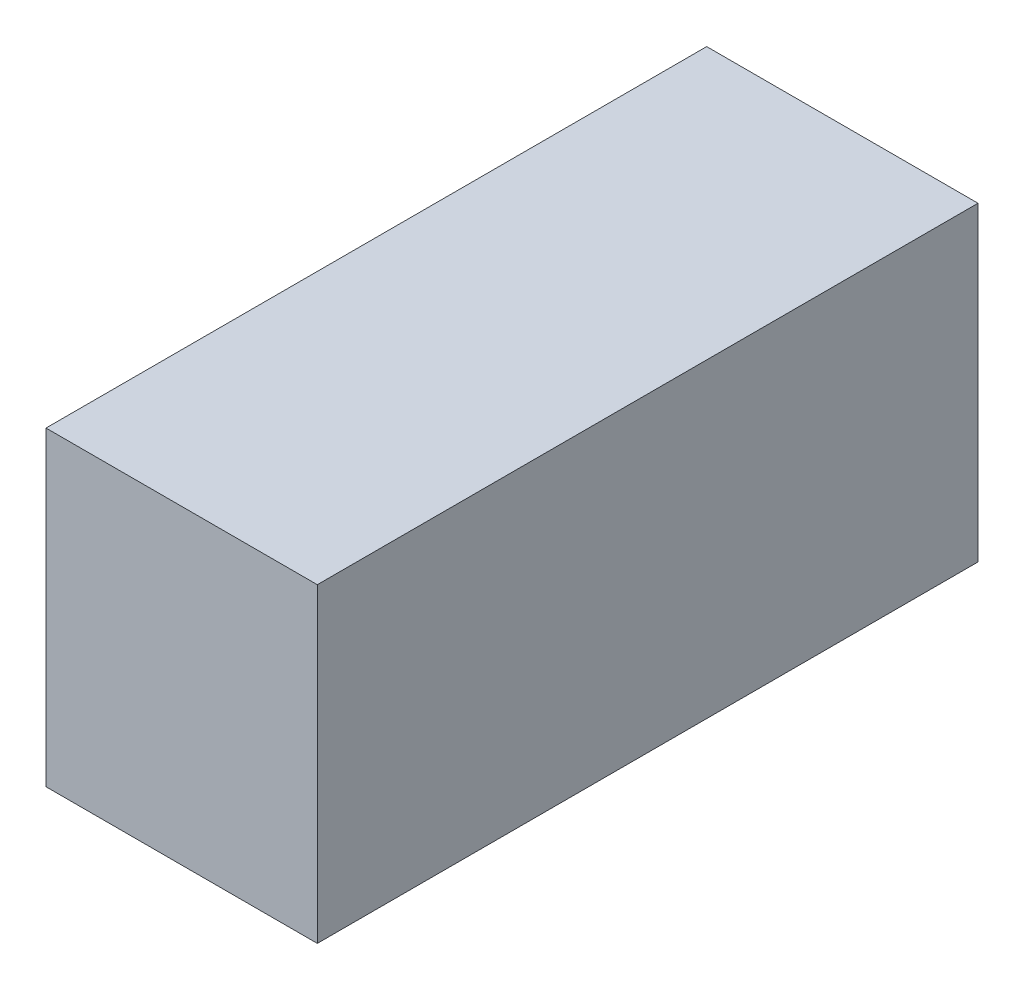
from build123d import *

# Parameters (mm, degrees)
SKETCH1_W           = 131
SKETCH1_H           = 150
BOSS_EXTRUDE1_DEPTH = 319


with BuildPart() as part:
    # Sketch1 → Boss-Extrude1 (new body)
    with BuildSketch(Plane.XY):
        with Locations((6.894736842, -41.388157895)):
            Rectangle(SKETCH1_W, SKETCH1_H)
    extrude(amount=BOSS_EXTRUDE1_DEPTH)


solid = part.part
